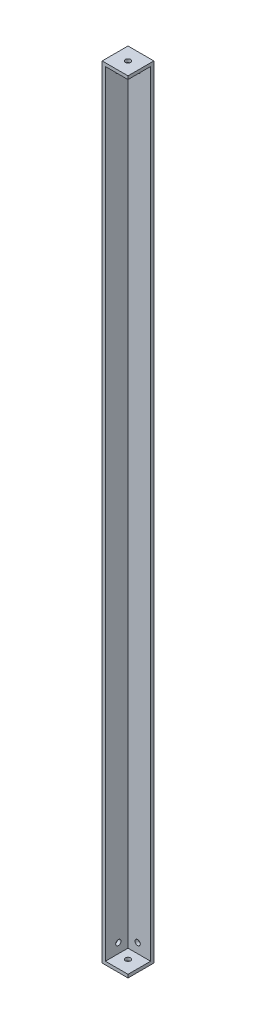
from build123d import *

# Parameters (mm, degrees)
SKETCH_1_W          = 40
SKETCH_1_H          = 40
EXTRUDE_1_DEPTH     = 5
SKETCH_2_R          = 4.05
CUT_EXTRUDE_1_DEPTH = 5
EXTRUDE_2_DEPTH     = 600
EXTRUDE_START       = 5
SKETCH_4_W          = 40
SKETCH_4_H          = 40
SKETCH_4_R          = 4.05
EXTRUDE_3_DEPTH     = 5
SKETCH_5_R          = 4.05
CUT_EXTRUDE_2_DEPTH = 5
SKETCH_6_R          = 4.05
CUT_EXTRUDE_3_DEPTH = 5


with BuildPart() as part:
    # 草图1 → 凸台-拉伸1 (new body)
    with BuildSketch(Plane(origin=(0, 0, 0), x_dir=(1, 0, 0), z_dir=(0, 1, 0))):
        Rectangle(SKETCH_1_W, SKETCH_1_H)
    extrude(amount=EXTRUDE_1_DEPTH)

    # 草图2 → 切除-拉伸1 (cut)
    with BuildSketch(Plane(origin=(0, 5, 0), x_dir=(1, 0, 0), z_dir=(0, 1, 0))):
        with Locations(Location((0, 0, 0), (0, 0, 270))):
            Circle(SKETCH_2_R)
    extrude(amount=-CUT_EXTRUDE_1_DEPTH, mode=Mode.SUBTRACT)

    # 草图3 → 凸台-拉伸2 (add)
    with BuildSketch(Plane(origin=(0, 5, 0), x_dir=(1, 0, 0), z_dir=(0, 1, 0))):
        Polygon((-20, 20), (-20, -20), (-15, -20), (-15, 15), (20, 15), (20, 20), align=None)
    extrude_2 = extrude(amount=EXTRUDE_2_DEPTH)

    # 镜向1: 凸台-拉伸2 across plane
    add(extrude_2.mirror(Plane.ZX.offset(605)))

    # 草图4 → 凸台-拉伸3 (add)
    with BuildSketch(Plane(origin=(0, 1205, 0), x_dir=(1, 0, 0), z_dir=(0, 1, 0)).offset(EXTRUDE_START)):
        Rectangle(SKETCH_4_W, SKETCH_4_H)
        with Locations(Location((0, 0, 0), (0, 0, 270))):
            Circle(SKETCH_4_R, mode=Mode.SUBTRACT)
    extrude(amount=-EXTRUDE_3_DEPTH)

    # 草图5 → 切除-拉伸2 (cut)
    with BuildSketch(Plane.XY.offset(-15)):
        with Locations((0, 20)):
            Circle(SKETCH_5_R)
    cut_extrude_2 = extrude(amount=-CUT_EXTRUDE_2_DEPTH, mode=Mode.SUBTRACT)

    # 镜向2: 切除-拉伸2 across plane
    add(cut_extrude_2.mirror(Plane(origin=(0, 605, 0), x_dir=(0, 0, 1), z_dir=(0, -1, 0))), mode=Mode.SUBTRACT)

    # 草图6 → 切除-拉伸3 (cut)
    with BuildSketch(Plane(origin=(-15, 0, 0), x_dir=(0, 0, -1), z_dir=(1, 0, 0))):
        with Locations((0, 20)):
            Circle(SKETCH_6_R)
    cut_extrude_3 = extrude(amount=-CUT_EXTRUDE_3_DEPTH, mode=Mode.SUBTRACT)

    # 镜向3: 切除-拉伸3 across plane
    add(cut_extrude_3.mirror(Plane(origin=(0, 605, 0), x_dir=(0, 0, 1), z_dir=(0, -1, 0))), mode=Mode.SUBTRACT)


solid = part.part
